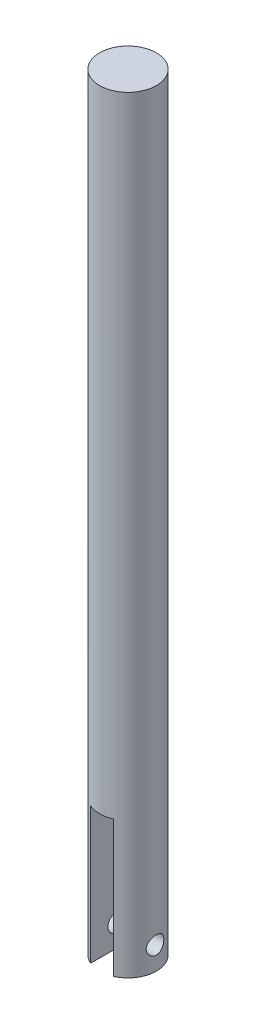
from build123d import *

# Parameters (mm, degrees)
SKETCH1_R               = 5
BOSS_EXTRUDE1_DEPTH     = 67.5
CUT_EXTRUDE1_DEPTH      = 68.869359802
CUT_EXTRUDE1_DEPTH_BACK = 68.869359802
SKETCH2_W               = 4
SKETCH2_H               = 24
CUT_EXTRUDE2_DEPTH      = 68.869359802
CUT_EXTRUDE2_DEPTH_BACK = 68.869359802
SKETCH3_R               = 1.55


with BuildPart() as part:
    # Sketch1 → Boss-Extrude1 (new, symmetric)
    with BuildSketch(Plane(origin=(0, 0, 0), x_dir=(1, 0, 0), z_dir=(0, 1, 0))):
        with Locations(Location((0, 0, 0), (0, 0, 270))):
            Circle(SKETCH1_R)
    extrude(amount=BOSS_EXTRUDE1_DEPTH, both=True)

    # Sketch2 → Cut-Extrude1 (cut, two sides: drawn at the far end of the back side and taken through both)
    with BuildSketch(Plane.XY.offset(-CUT_EXTRUDE1_DEPTH_BACK)):
        with Locations((0, -55.5)):
            Rectangle(SKETCH2_W, SKETCH2_H)
    extrude(amount=CUT_EXTRUDE1_DEPTH + CUT_EXTRUDE1_DEPTH_BACK, mode=Mode.SUBTRACT)

    # Sketch3 → Cut-Extrude2 (cut, two sides: drawn at the far end of the back side and taken through both)
    with BuildSketch(Plane(origin=(0, 0, 0), x_dir=(0, 0, -1), z_dir=(1, 0, 0)).offset(-CUT_EXTRUDE2_DEPTH_BACK)):
        with Locations((0, -63.5)):
            Circle(SKETCH3_R)
    extrude(amount=CUT_EXTRUDE2_DEPTH + CUT_EXTRUDE2_DEPTH_BACK, mode=Mode.SUBTRACT)


solid = part.part
